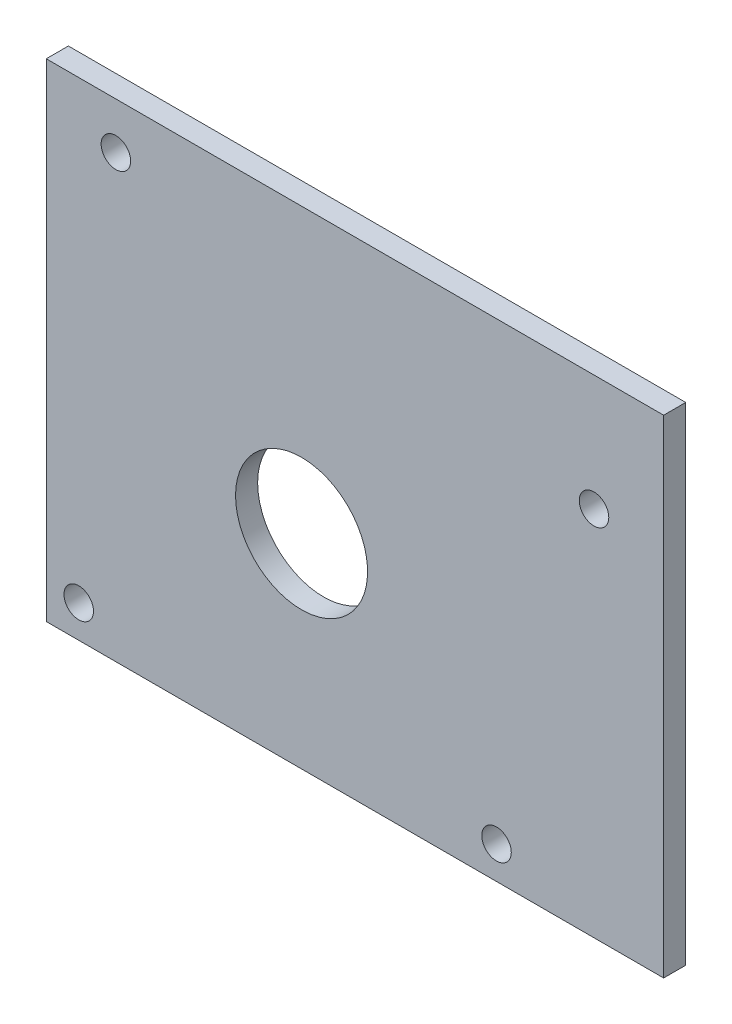
from build123d import *

# Parameters (mm, degrees)
SKETCH1_W           = 133
SKETCH1_H           = 105
SKETCH1_R           = 14.225
BOSS_EXTRUDE2_DEPTH = 4.7625
CUT_EXTRUDE1_REACH  = 115.05
SKETCH2_R           = 3.18


with BuildPart() as part:
    # Sketch1 → Boss-Extrude2 (new body)
    with BuildSketch(Plane.XY):
        with Locations((-18.535460993, 21.841271178)):
            Rectangle(SKETCH1_W, SKETCH1_H)
        with Locations(Location((-30.035460993, 13.261258957, 0), (0, 0, 180))):
            Circle(SKETCH1_R, mode=Mode.SUBTRACT)
    extrude(amount=BOSS_EXTRUDE2_DEPTH)

    # Sketch2 → Cut-Extrude1 (cut, up to next)
    with BuildSketch(Plane.XY.offset(4.7625), mode=Mode.PRIVATE) as cut_extrude1_sk1:
        with Locations((-70.035460993, 64.341271178)):
            Circle(SKETCH2_R)
    cut_extrude1_tool1 = extrude(cut_extrude1_sk1.sketch, amount=-CUT_EXTRUDE1_REACH, mode=Mode.PRIVATE) & part.part
    # Sketch2 → Cut-Extrude1 (cut, up to next)
    with BuildSketch(Plane.XY.offset(4.7625), mode=Mode.PRIVATE) as cut_extrude1_sk2:
        with Locations((32.964539007, 49.341271178)):
            Circle(SKETCH2_R)
    cut_extrude1_tool2 = extrude(cut_extrude1_sk2.sketch, amount=-CUT_EXTRUDE1_REACH, mode=Mode.PRIVATE) & part.part
    # Sketch2 → Cut-Extrude1 (cut, up to next)
    with BuildSketch(Plane.XY.offset(4.7625), mode=Mode.PRIVATE) as cut_extrude1_sk3:
        with Locations((11.964539007, -23.658728822)):
            Circle(SKETCH2_R)
    cut_extrude1_tool3 = extrude(cut_extrude1_sk3.sketch, amount=-CUT_EXTRUDE1_REACH, mode=Mode.PRIVATE) & part.part
    # Sketch2 → Cut-Extrude1 (cut, up to next)
    with BuildSketch(Plane.XY.offset(4.7625), mode=Mode.PRIVATE) as cut_extrude1_sk4:
        with Locations((-78.035460993, -23.658728822)):
            Circle(SKETCH2_R)
    cut_extrude1_tool4 = extrude(cut_extrude1_sk4.sketch, amount=-CUT_EXTRUDE1_REACH, mode=Mode.PRIVATE) & part.part
    add(cut_extrude1_tool1.solids().sort_by_distance((-70.035461, 64.341271, 4.7625))[0], mode=Mode.SUBTRACT)
    add(cut_extrude1_tool2.solids().sort_by_distance((32.964539, 49.341271, 4.7625))[0], mode=Mode.SUBTRACT)
    add(cut_extrude1_tool3.solids().sort_by_distance((11.964539, -23.658729, 4.7625))[0], mode=Mode.SUBTRACT)
    add(cut_extrude1_tool4.solids().sort_by_distance((-78.035461, -23.658729, 4.7625))[0], mode=Mode.SUBTRACT)


solid = part.part
